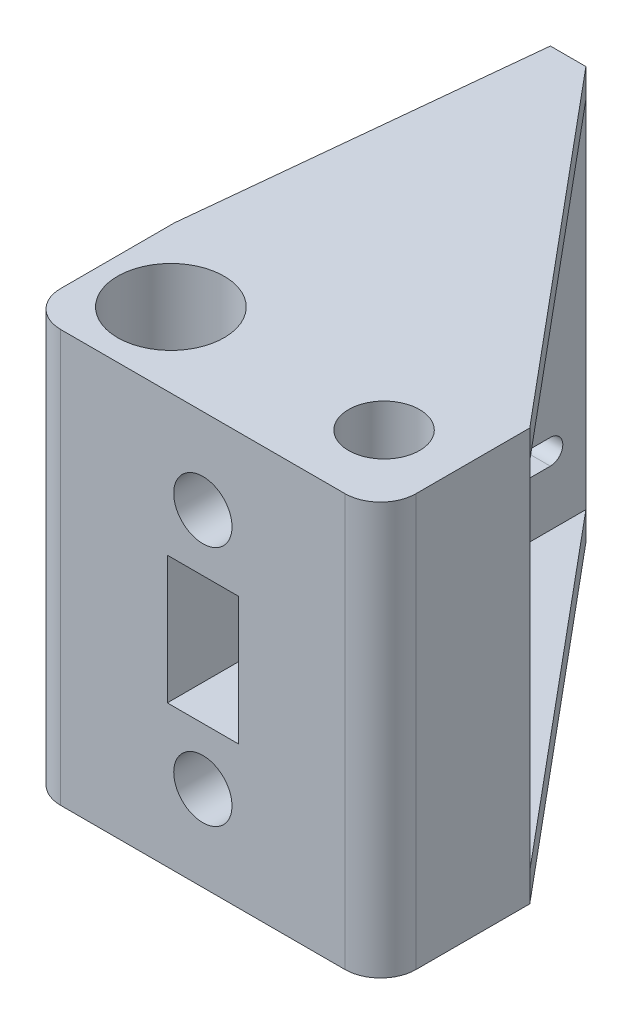
from build123d import *

# Parameters (mm, degrees)
SKETCH1_W           = 50
SKETCH1_H           = 21
BOSS_EXTRUDE1_DEPTH = 58
SKETCH3_R           = 7.5
CUT_EXTRUDE1_DEPTH  = 24
CUT_EXTRUDE2_REACH  = 66.025
SKETCH4_R           = 5
CUT_EXTRUDE3_START  = -24
SKETCH5_R           = 7.5
CUT_EXTRUDE3_DEPTH  = 24
CUT_EXTRUDE4_REACH  = 66.025
SKETCH6_R           = 4.5
CUT_EXTRUDE5_REACH  = 68.558
SKETCH8_W           = 10
SKETCH8_H           = 18
SKETCH9_W           = 5
SKETCH9_H           = 58
BOSS_EXTRUDE3_DEPTH = 48
CUT_EXTRUDE7_REACH  = 95.916
BOSS_EXTRUDE4_DEPTH = 4
FILLET1_R           = 5
SKETCH7_R           = 4.1
CUT_EXTRUDE8_DEPTH  = 15


with BuildPart() as part:
    # Sketch1 → Boss-Extrude1 (new body)
    with BuildSketch(Plane(origin=(0, 0, 0), x_dir=(1, 0, 0), z_dir=(0, 1, 0))):
        Rectangle(SKETCH1_W, SKETCH1_H)
    extrude(amount=BOSS_EXTRUDE1_DEPTH)

    # Sketch3 → Cut-Extrude1 (cut)
    with BuildSketch(Plane(origin=(0, 58, 0), x_dir=(1, 0, 0), z_dir=(0, 1, 0))):
        with Locations(Location((-15, 0, 0), (0, 0, 270))):
            Circle(SKETCH3_R)
    extrude(amount=-CUT_EXTRUDE1_DEPTH, mode=Mode.SUBTRACT)

    # Sketch4 → Cut-Extrude2 (cut, up to next)
    with BuildSketch(Plane(origin=(0, 58, 0), x_dir=(1, 0, 0), z_dir=(0, 1, 0)), mode=Mode.PRIVATE) as cut_extrude2_sk1:
        with Locations(Location((15, 0, 0), (0, 0, 270))):
            Circle(SKETCH4_R)
    cut_extrude2_tool1 = extrude(cut_extrude2_sk1.sketch, amount=-CUT_EXTRUDE2_REACH, mode=Mode.PRIVATE) & part.part
    add(cut_extrude2_tool1.solids().sort_by_distance((15, 58, 0))[0], mode=Mode.SUBTRACT)

    # Sketch5 → Cut-Extrude3 (cut)
    with BuildSketch(Plane.XZ.offset(CUT_EXTRUDE3_START)):
        with Locations(Location((-15, 0, 0), (0, 0, 90))):
            Circle(SKETCH5_R)
    extrude(amount=CUT_EXTRUDE3_DEPTH, mode=Mode.SUBTRACT)

    # Sketch6 → Cut-Extrude4 (cut, up to next)
    with BuildSketch(Plane.XZ, mode=Mode.PRIVATE) as cut_extrude4_sk1:
        with Locations(Location((-15, 0, 0), (0, 0, 270))):
            Circle(SKETCH6_R)
    cut_extrude4_tool1 = extrude(cut_extrude4_sk1.sketch, amount=-CUT_EXTRUDE4_REACH, mode=Mode.PRIVATE) & part.part
    add(cut_extrude4_tool1.solids().sort_by_distance((-15, 0, 0))[0], mode=Mode.SUBTRACT)

    # Sketch8 → Cut-Extrude5 (cut, up to next)
    with BuildSketch(Plane.XY.offset(10.5), mode=Mode.PRIVATE) as cut_extrude5_sk1:
        with Locations((0, 29)):
            Rectangle(SKETCH8_W, SKETCH8_H)
    cut_extrude5_tool1 = extrude(cut_extrude5_sk1.sketch, amount=-CUT_EXTRUDE5_REACH, mode=Mode.PRIVATE) & part.part
    add(cut_extrude5_tool1.solids().sort_by_distance((0, 29, 10.5))[0], mode=Mode.SUBTRACT)

    # Sketch9 → Boss-Extrude3 (add)
    with BuildSketch(Plane(origin=(0, 0, -10.5), x_dir=(-1, 0, 0), z_dir=(0, 0, -1))):
        with Locations((17.6, 29)):
            Rectangle(SKETCH9_W, SKETCH9_H)
    extrude(amount=BOSS_EXTRUDE3_DEPTH)

    # Sketch10 → Cut-Extrude7 (cut, up to next)
    with BuildSketch(Plane.ZY.offset(20.1), mode=Mode.PRIVATE) as cut_extrude7_sk1:
        with BuildLine():
            Line((-41.5, 17), (-27.5, 17))
            ThreePointArc((-27.5, 17), (-23.964466094, 18.464466094), (-22.5, 22))
            Line((-22.5, 22), (-22.5, 36))
            ThreePointArc((-22.5, 36), (-23.964466094, 39.535533906), (-27.5, 41))
            Line((-27.5, 41), (-41.5, 41))
            ThreePointArc((-41.5, 41), (-45.035533906, 39.535533906), (-46.5, 36))
            Line((-46.5, 36), (-46.5, 22))
            ThreePointArc((-46.5, 22), (-45.035533906, 18.464466094), (-41.5, 17))
        make_face()
    cut_extrude7_tool1 = extrude(cut_extrude7_sk1.sketch, amount=-CUT_EXTRUDE7_REACH, mode=Mode.PRIVATE) & part.part
    # Sketch10 → Cut-Extrude7 (cut, up to next)
    with BuildSketch(Plane.ZY.offset(20.1), mode=Mode.PRIVATE) as cut_extrude7_sk2:
        with BuildLine():
            Line((-15.5, 42.7), (-53.5, 42.7))
            ThreePointArc((-53.5, 42.7), (-55.25, 44.45), (-53.5, 46.2))
            Line((-53.5, 46.2), (-15.5, 46.2))
            ThreePointArc((-15.5, 46.2), (-13.75, 44.45), (-15.5, 42.7))
        make_face()
    cut_extrude7_tool2 = extrude(cut_extrude7_sk2.sketch, amount=-CUT_EXTRUDE7_REACH, mode=Mode.PRIVATE) & part.part
    # Sketch10 → Cut-Extrude7 (cut, up to next)
    with BuildSketch(Plane.ZY.offset(20.1), mode=Mode.PRIVATE) as cut_extrude7_sk3:
        with BuildLine():
            Line((-15.5, 15.3), (-53.5, 15.3))
            ThreePointArc((-53.5, 15.3), (-55.25, 13.55), (-53.5, 11.8))
            Line((-53.5, 11.8), (-15.5, 11.8))
            ThreePointArc((-15.5, 11.8), (-13.75, 13.55), (-15.5, 15.3))
        make_face()
    cut_extrude7_tool3 = extrude(cut_extrude7_sk3.sketch, amount=-CUT_EXTRUDE7_REACH, mode=Mode.PRIVATE) & part.part
    add(cut_extrude7_tool1.solids().sort_by_distance((-20.1, 29, -34.5))[0], mode=Mode.SUBTRACT)
    add(cut_extrude7_tool2.solids().sort_by_distance((-20.1, 44.45, -34.5))[0], mode=Mode.SUBTRACT)
    add(cut_extrude7_tool3.solids().sort_by_distance((-20.1, 13.55, -34.5))[0], mode=Mode.SUBTRACT)

    # Sketch11 → Boss-Extrude4 (add)
    with BuildSketch(Plane(origin=(0, 0, 0), x_dir=(-1, 0, 0), z_dir=(0, -1, 0))):
        Polygon((15.1, 58.5), (-25, 10.5), (15.1, 10.5), align=None)
        Polygon((20.1, 58.5), (20.1, 10.5), (25, 10.5), align=None)
    boss_extrude4 = extrude(amount=-BOSS_EXTRUDE4_DEPTH)

    # Mirror1: Boss-Extrude4 across plane
    add(boss_extrude4.mirror(Plane(origin=(0, 29, 0), x_dir=(0, 0, 1), z_dir=(0, -1, 0))))

    # Fillet1
    fillet1_edges = [part.edges().sort_by_distance(p)[0] for p in [
        (25, 29, 10.5),
        (-25, 29, 10.5),
    ]]
    fillet(fillet1_edges, radius=FILLET1_R)

    # Sketch7 → Cut-Extrude8 (cut)
    with BuildSketch(Plane.XY.offset(10.5)):
        with Locations((0, 46)):
            Circle(SKETCH7_R)
        with Locations(Location((0, 12, 0), (0, 0, 180))):
            Circle(SKETCH7_R)
    extrude(amount=-CUT_EXTRUDE8_DEPTH, mode=Mode.SUBTRACT)


solid = part.part
